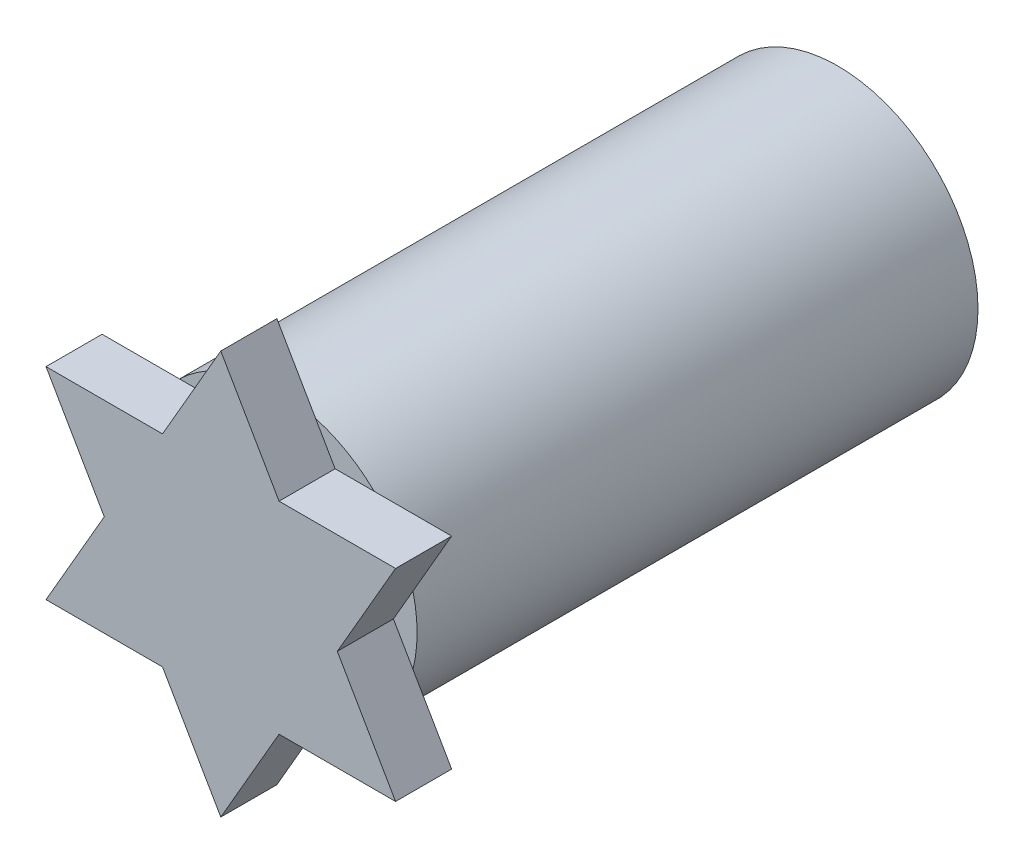
from build123d import *

# Parameters (mm, degrees)
SKETCH_1_R      = 2.5
EXTRUDE_1_DEPTH = 10
EXTRUDE_2_DEPTH = 1


with BuildPart() as part:
    # 스케치1 → 보스-돌출1 (new body)
    with BuildSketch(Plane.XY):
        Circle(SKETCH_1_R)
    extrude(amount=EXTRUDE_1_DEPTH)

    # 스케치2 → 보스-돌출2 (add)
    with BuildSketch(Plane.XY.offset(10)):
        with BuildLine():
            ThreePointArc((-2.425994905, 0.603778702), (-2.165063509, 1.25), (-1.735885147, 1.799083866))
            Line((-1.735885147, 1.799083866), (-3.116104663, 1.799083866))
            Line((-3.116104663, 1.799083866), (-2.425994905, 0.603778702))
        make_face()
        with BuildLine():
            Line((-2.077403109, 0), (-1.038701554, 1.799083866))
            Line((-1.038701554, 1.799083866), (-1.735885147, 1.799083866))
            ThreePointArc((-1.735885147, 1.799083866), (-2.165063509, 1.25), (-2.425994905, 0.603778702))
            Line((-2.425994905, 0.603778702), (-2.077403109, 0))
        make_face()
        with BuildLine():
            Line((-1.038701554, 1.799083866), (1.038701554, 1.799083866))
            Line((1.038701554, 1.799083866), (0.690109758, 2.402862568))
            ThreePointArc((0.690109758, 2.402862568), (0, 2.5), (-0.690109758, 2.402862568))
            Line((-0.690109758, 2.402862568), (-1.038701554, 1.799083866))
        make_face()
        with BuildLine():
            Line((2.425994905, 0.603778702), (3.116104663, 1.799083866))
            Line((3.116104663, 1.799083866), (1.735885147, 1.799083866))
            ThreePointArc((1.735885147, 1.799083866), (2.165063509, 1.25), (2.425994905, 0.603778702))
        make_face()
        with BuildLine():
            ThreePointArc((2.425994905, 0.603778702), (2.165063509, 1.25), (1.735885147, 1.799083866))
            Line((1.735885147, 1.799083866), (1.038701554, 1.799083866))
            Line((1.038701554, 1.799083866), (2.077403109, 0))
            Line((2.077403109, 0), (2.425994905, 0.603778702))
        make_face()
        with BuildLine():
            Line((3.116104663, -1.799083866), (2.425994905, -0.603778702))
            ThreePointArc((2.425994905, -0.603778702), (2.165063509, -1.25), (1.735885147, -1.799083866))
            Line((1.735885147, -1.799083866), (3.116104663, -1.799083866))
        make_face()
        with BuildLine():
            Line((2.425994905, -0.603778702), (2.077403109, 0))
            Line((2.077403109, 0), (1.038701554, -1.799083866))
            Line((1.038701554, -1.799083866), (1.735885147, -1.799083866))
            ThreePointArc((1.735885147, -1.799083866), (2.165063509, -1.25), (2.425994905, -0.603778702))
        make_face()
        with BuildLine():
            Line((0, -3.598167732), (0.690109758, -2.402862568))
            ThreePointArc((0.690109758, -2.402862568), (0, -2.5), (-0.690109758, -2.402862568))
            Line((-0.690109758, -2.402862568), (0, -3.598167732))
        make_face()
        with BuildLine():
            Line((0.690109758, -2.402862568), (1.038701554, -1.799083866))
            Line((1.038701554, -1.799083866), (-1.038701554, -1.799083866))
            Line((-1.038701554, -1.799083866), (-0.690109758, -2.402862568))
            ThreePointArc((-0.690109758, -2.402862568), (0, -2.5), (0.690109758, -2.402862568))
        make_face()
        with BuildLine():
            Line((-1.038701554, -1.799083866), (-2.077403109, 0))
            Line((-2.077403109, 0), (-2.425994905, -0.603778702))
            ThreePointArc((-2.425994905, -0.603778702), (-2.165063509, -1.25), (-1.735885147, -1.799083866))
            Line((-1.735885147, -1.799083866), (-1.038701554, -1.799083866))
        make_face()
        with BuildLine():
            ThreePointArc((-1.735885147, -1.799083866), (-2.165063509, -1.25), (-2.425994905, -0.603778702))
            Line((-2.425994905, -0.603778702), (-3.116104663, -1.799083866))
            Line((-3.116104663, -1.799083866), (-1.735885147, -1.799083866))
        make_face()
        Polygon((0, -3.598167732), (3.116104663, 1.799083866), (-3.116104663, 1.799083866), align=None)
        Polygon((3.116104663, -1.799083866), (0, 3.598167732), (-3.116104663, -1.799083866), align=None)
        with BuildLine():
            ThreePointArc((-0.690109758, 2.402862568), (0, 2.5), (0.690109758, 2.402862568))
            Line((0.690109758, 2.402862568), (0, 3.598167732))
            Line((0, 3.598167732), (-0.690109758, 2.402862568))
        make_face()
    extrude(amount=EXTRUDE_2_DEPTH)


solid = part.part
